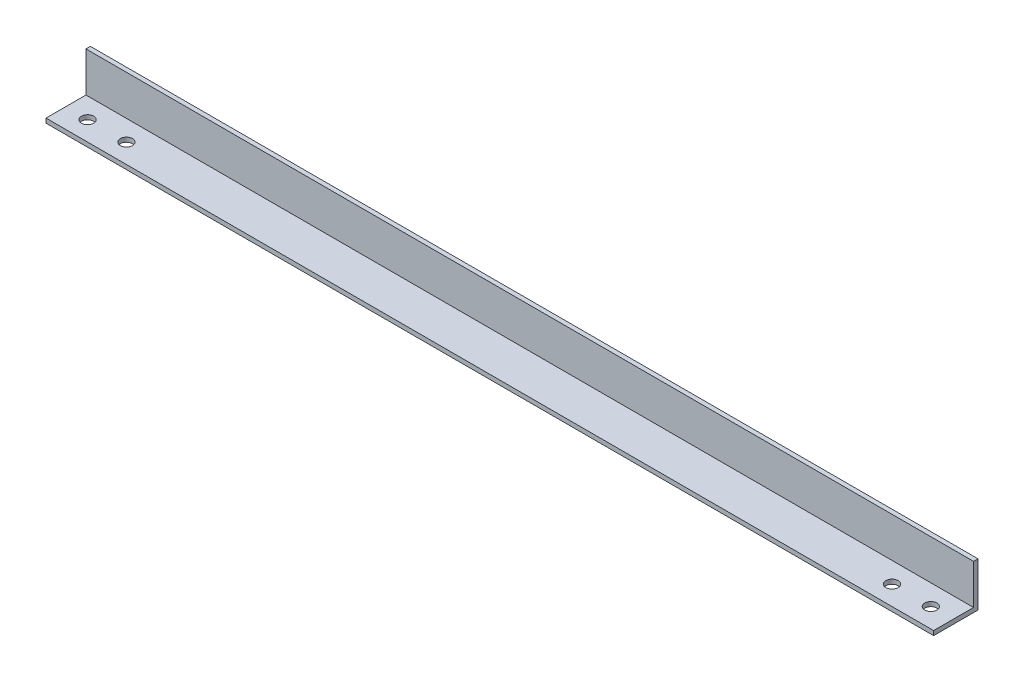
from build123d import *

# Parameters (mm, degrees)
SKETCH_198_W        = 1600
SKETCH_198_H        = 80
EXTRUDE_4_DEPTH     = 8
SKETCH_3_W          = 1600
SKETCH_3_H          = 8
EXTRUDE_5_DEPTH     = 72
SKETCH_4_R          = 11
CUT_EXTRUDE_2_DEPTH = 1604.615914114


with BuildPart() as part:
    # Sketch 198 → 拉伸4 (new body)
    with BuildSketch(Plane.XY):
        with Locations((800, 40)):
            Rectangle(SKETCH_198_W, SKETCH_198_H)
    extrude(amount=EXTRUDE_4_DEPTH)

    # 草图3 → 拉伸5 (add)
    with BuildSketch(Plane.XY.offset(8)):
        with Locations((800, 4)):
            Rectangle(SKETCH_3_W, SKETCH_3_H)
    extrude(amount=EXTRUDE_5_DEPTH)

    # 草图4 → 切除-拉伸2 (cut, through all)
    with BuildSketch(Plane(origin=(0, 8, 0), x_dir=(1, 0, 0), z_dir=(0, 1, 0))):
        with Locations(Location((40, -45, 0), (0, 0, 270))):
            Circle(SKETCH_4_R)
        with Locations(Location((110, -45, 0), (0, 0, 270))):
            Circle(SKETCH_4_R)
        with Locations(Location((1490, -45, 0), (0, 0, 270))):
            Circle(SKETCH_4_R)
        with Locations(Location((1560, -45, 0), (0, 0, 270))):
            Circle(SKETCH_4_R)
    extrude(amount=-CUT_EXTRUDE_2_DEPTH, mode=Mode.SUBTRACT)


solid = part.part
